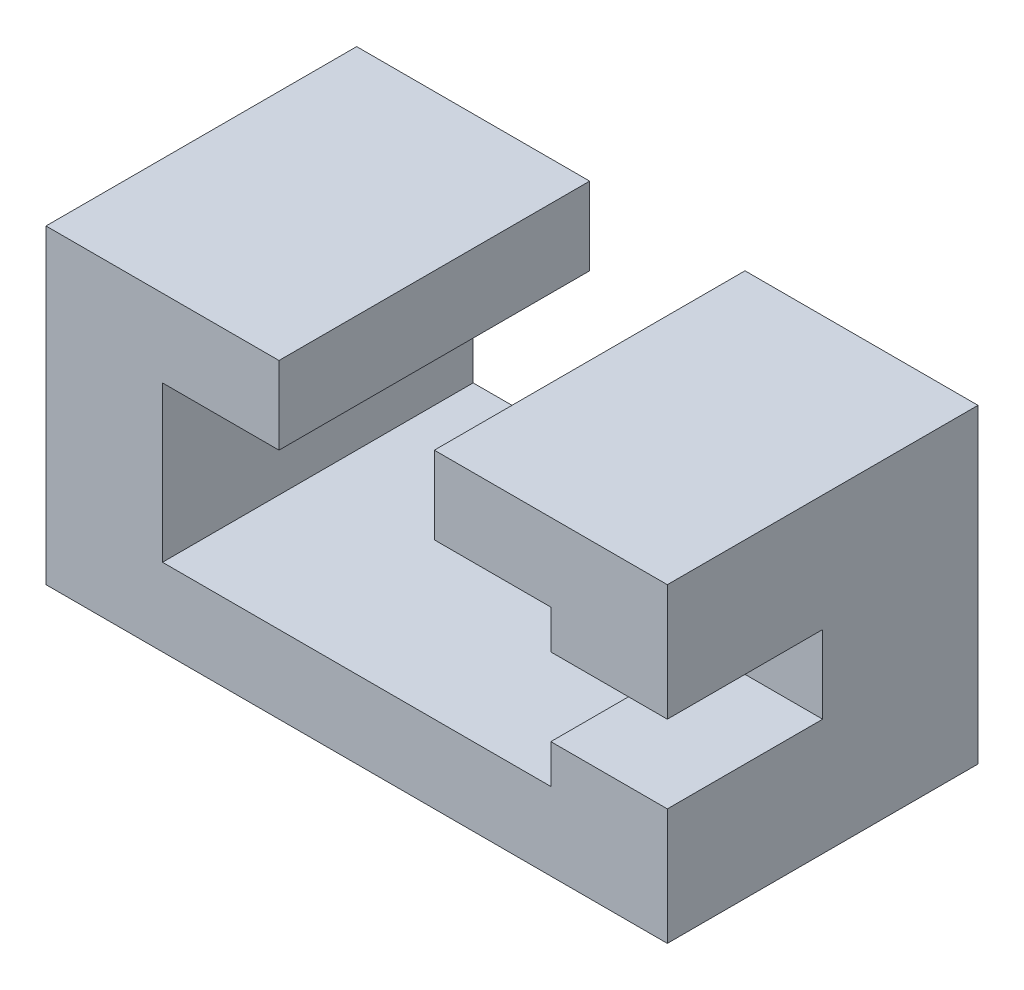
from build123d import *

# Parameters (mm, degrees)
BOSS_EXTRUDE1_DEPTH = 40
CUT_EXTRUDE1_REACH  = 99.98
SKETCH2_W           = 20
SKETCH2_H           = 10


with BuildPart() as part:
    # Sketch1 → Boss-Extrude1 (new body)
    with BuildSketch(Plane.XY):
        Polygon((0, 40), (0, 0), (80, 0), (80, 40), (50, 40), (50, 30), (65, 30), (65, 10), (15, 10), (15, 30), (30, 30), (30, 40), align=None)
    extrude(amount=BOSS_EXTRUDE1_DEPTH)

    # Sketch2 → Cut-Extrude1 (cut, up to next)
    with BuildSketch(Plane(origin=(80, 0, 0), x_dir=(0, 0, -1), z_dir=(1, 0, 0)), mode=Mode.PRIVATE) as cut_extrude1_sk1:
        with Locations((-30, 20)):
            Rectangle(SKETCH2_W, SKETCH2_H)
    cut_extrude1_tool1 = extrude(cut_extrude1_sk1.sketch, amount=-CUT_EXTRUDE1_REACH, mode=Mode.PRIVATE) & part.part
    add(cut_extrude1_tool1.solids().sort_by_distance((80, 20, 30))[0], mode=Mode.SUBTRACT)


solid = part.part
